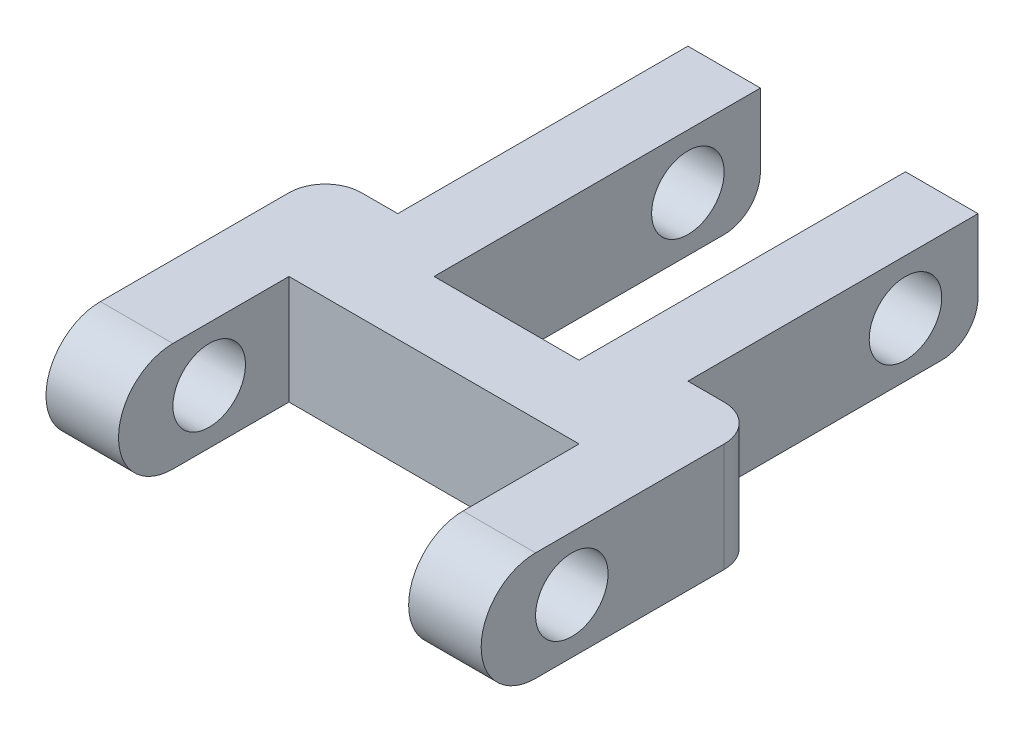
from build123d import *

# Parameters (mm, degrees)
EXTRUDE_1_DEPTH     = 3
SKETCH_2_OUTSIDE_W  = 13.724
SKETCH_2_OUTSIDE_H  = 8.024
CUT_EXTRUDE_1_DEPTH = 12
SKETCH_3_R          = 1
CUT_EXTRUDE_2_DEPTH = 12
FILLET_1_R          = 1
SKETCH_4_R          = 0.95
EXTRUDE_2_DEPTH     = 2
SKETCH_5_W          = 8
SKETCH_5_H          = 3
EXTRUDE_3_DEPTH     = 6
SKETCH_6_R          = 1
CUT_EXTRUDE_3_DEPTH = 12
CUT_EXTRUDE_4_DEPTH = 8
FILLET_2_R          = 1
SKETCH_11_W         = 8
SKETCH_11_H         = 3
EXTRUDE_4_DEPTH     = 2
SKETCH_12_W         = 4
SKETCH_12_H         = 4
CUT_EXTRUDE_5_DEPTH = 10


with BuildPart() as part:
    # 草图1 → 凸台-拉伸1 (new body)
    with BuildSketch(Plane(origin=(0, 0, 0), x_dir=(1, 0, 0), z_dir=(0, 1, 0))):
        Polygon((-6, 0), (6, 0), (6, -8.7), (4, -8.7), (4, -3), (-4, -3), (-4, -8.7), (-6, -8.7), align=None)
    extrude(amount=EXTRUDE_1_DEPTH)

    # 草图2 outside → 切除-拉伸1 (cut)
    with BuildSketch(Plane.ZY.offset(6)):
        with Locations((4.35, 1.5)):
            Rectangle(SKETCH_2_OUTSIDE_W, SKETCH_2_OUTSIDE_H)
        with BuildLine():
            Line((6.2, 3), (0, 3))
            Line((0, 3), (0, 0))
            Line((0, 0), (6.2, 0))
            ThreePointArc((6.2, 0), (7.7, 1.5), (6.2, 3))
        make_face(mode=Mode.SUBTRACT)
    extrude(amount=-CUT_EXTRUDE_1_DEPTH, mode=Mode.SUBTRACT)

    # 草图3 → 切除-拉伸2 (cut)
    with BuildSketch(Plane.ZY.offset(6)):
        with Locations((5.2, 1.5)):
            Circle(SKETCH_3_R)
    extrude(amount=-CUT_EXTRUDE_2_DEPTH, mode=Mode.SUBTRACT)

    # 圆角1
    fillet_1_edges = [part.edges().sort_by_distance(p)[0] for p in [
        (-6, 1.5, 0),
        (6, 1.5, 0),
    ]]
    fillet(fillet_1_edges, radius=FILLET_1_R)

    # 草图4 → 凸台-拉伸2 (add)
    with BuildSketch(Plane(origin=(0, 0, 0), x_dir=(-1, 0, 0), z_dir=(0, 0, -1))):
        with Locations(Location((0, 1.5, 0), (0, 0, 180))):
            Circle(SKETCH_4_R)
    extrude(amount=EXTRUDE_2_DEPTH)

    # 草图5 → 凸台-拉伸3 (add)
    with BuildSketch(Plane(origin=(0, 0, -2), x_dir=(-1, 0, 0), z_dir=(0, 0, -1))):
        with Locations((0, 1.5)):
            Rectangle(SKETCH_5_W, SKETCH_5_H)
    extrude(amount=EXTRUDE_3_DEPTH)

    # 草图6 → 切除-拉伸3 (cut)
    with BuildSketch(Plane(origin=(4, 0, 0), x_dir=(0, 0, -1), z_dir=(1, 0, 0))):
        with Locations(Location((6, 1.5, 0), (0, 0, 90))):
            Circle(SKETCH_6_R)
    extrude(amount=-CUT_EXTRUDE_3_DEPTH, mode=Mode.SUBTRACT)

    # 草图8 → 切除-拉伸4 (cut)
    with BuildSketch(Plane(origin=(0, 3, 0), x_dir=(1, 0, 0), z_dir=(0, 1, 0))):
        Polygon((-2, 10), (2, 8), (2, 3), (-2, 3), align=None)
    extrude(amount=-CUT_EXTRUDE_4_DEPTH, mode=Mode.SUBTRACT)

    # 圆角2
    fillet_2_edges = [part.edges().sort_by_distance(p)[0] for p in [
        (-3, 0, -8),
        (3, 0, -8),
    ]]
    fillet(fillet_2_edges, radius=FILLET_2_R)

    # 草图11 → 凸台-拉伸4 (add)
    with BuildSketch(Plane.XY.offset(-2)):
        with Locations((0, 1.5)):
            Rectangle(SKETCH_11_W, SKETCH_11_H)
    extrude(amount=EXTRUDE_4_DEPTH)

    # 草图12 → 切除-拉伸5 (cut)
    with BuildSketch(Plane(origin=(0, 3, 0), x_dir=(1, 0, 0), z_dir=(0, 1, 0))):
        with Locations((0, 1)):
            Rectangle(SKETCH_12_W, SKETCH_12_H)
    extrude(amount=-CUT_EXTRUDE_5_DEPTH, mode=Mode.SUBTRACT)


solid = part.part
